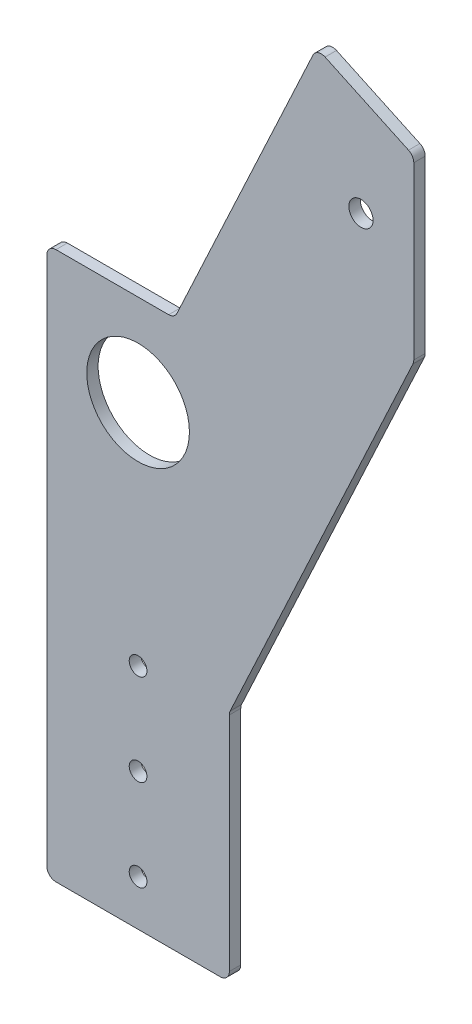
from build123d import *

# Parameters (mm, degrees)
BOSS_EXTRUDE1_DEPTH = 3.175
SKETCH2_R           = 3.3734375
CUT_EXTRUDE1_DEPTH  = 3.175
SKETCH3_R           = 2.4638
CUT_EXTRUDE2_DEPTH  = 3.175
SKETCH4_R           = 14.2875
CUT_EXTRUDE3_DEPTH  = 3.175
CUT_EXTRUDE4_DEPTH  = 222.091497051
FILLET1_R           = 2.54


with BuildPart() as part:
    # Sketch1 → Boss-Extrude1 (new body)
    with BuildSketch(Plane.XY):
        Polygon((49.741526937, 199.241524535), (10.132643551, 114.3), (-25.4, 114.3), (-25.4, 38.1), (-25.4, -38.1), (25.4, -38.1), (25.4, 26.837911138), (95.781962519, 177.772516839), align=None)
    extrude(amount=BOSS_EXTRUDE1_DEPTH)

    # Sketch2 → Cut-Extrude1 (cut)
    with BuildSketch(Plane.XY.offset(3.175)):
        with Locations((62.02724088, 165.486802896)):
            Circle(SKETCH2_R)
    extrude(amount=-CUT_EXTRUDE1_DEPTH, mode=Mode.SUBTRACT)

    # Sketch3 → Cut-Extrude2 (cut)
    with BuildSketch(Plane.XY.offset(3.175)):
        with Locations((0, -25.4)):
            Circle(SKETCH3_R)
        Circle(SKETCH3_R)
        with Locations((0, 25.4)):
            Circle(SKETCH3_R)
    extrude(amount=-CUT_EXTRUDE2_DEPTH, mode=Mode.SUBTRACT)

    # Sketch4 → Cut-Extrude3 (cut)
    with BuildSketch(Plane.XY.offset(3.175)):
        with Locations((0, 88.9)):
            Circle(SKETCH4_R)
    extrude(amount=-CUT_EXTRUDE3_DEPTH, mode=Mode.SUBTRACT)

    # Sketch5 → Cut-Extrude4 (cut, through all)
    with BuildSketch(Plane.XY.offset(3.175)):
        Polygon((76.731962519, 186.655677727), (76.731962519, 136.919660003), (95.781962519, 177.772516839), align=None)
    extrude(amount=-CUT_EXTRUDE4_DEPTH, mode=Mode.SUBTRACT)

    # Fillet1
    fillet1_edges = [part.edges().sort_by_distance(p)[0] for p in [
        (10.132643551, 114.3, 1.5875),
        (49.741526937, 199.241524535, 1.5875),
        (25.4, 26.837911138, 1.5875),
        (25.4, -38.1, 1.5875),
        (-25.4, -38.1, 1.5875),
        (-25.4, 114.3, 1.5875),
        (76.731962519, 186.655677727, 1.5875),
        (76.731962519, 136.919660003, 1.5875),
    ]]
    fillet(fillet1_edges, radius=FILLET1_R)


solid = part.part
